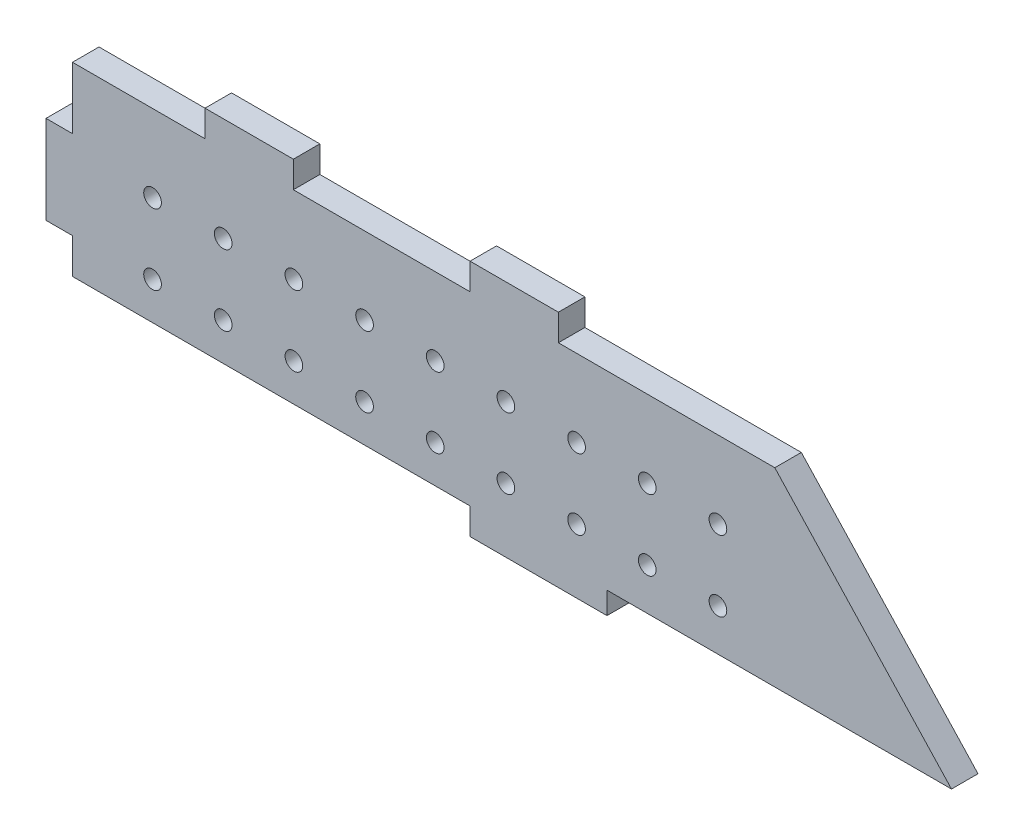
from build123d import *

# Parameters (mm, degrees)
ESQUISSE1_W             = 199
ESQUISSE1_H             = 48
BOSS_EXTRU_1_DEPTH      = 6
ESQUISSE2_W             = 20
ESQUISSE2_H             = 6
BOSS_EXTRU_2_DEPTH      = 6
ESQUISSE3_W             = 6
ESQUISSE3_H             = 20
BOSS_EXTRU_3_DEPTH      = 6
ESQUISSE4_W             = 78
ESQUISSE4_H             = 5
ENL_V_MAT_EXTRU_1_DEPTH = 213.077815907
ENL_V_MAT_EXTRU_2_DEPTH = 213.077815907
ESQUISSE6_R             = 1.005
ENL_V_MAT_EXTRU_3_DEPTH = 213.077815907
ESQUISSE7_R             = 2
ENL_V_MAT_EXTRU_4_DEPTH = 3
ESQUISSE8_W             = 90
ESQUISSE8_H             = 6
ENL_V_MAT_EXTRU_5_DEPTH = 213.077815907


with BuildPart() as part:
    # Esquisse1 → Boss.-Extru.1 (new body)
    with BuildSketch(Plane.XY):
        with Locations((-99.5, 24)):
            Rectangle(ESQUISSE1_W, ESQUISSE1_H)
    extrude(amount=BOSS_EXTRU_1_DEPTH)

    # Esquisse2 → Boss.-Extru.2 (add)
    with BuildSketch(Plane(origin=(0, 48, 0), x_dir=(1, 0, 0), z_dir=(0, 1, 0))):
        with Locations((-99, -3)):
            Rectangle(ESQUISSE2_W, ESQUISSE2_H)
        with Locations((-159, -3)):
            Rectangle(ESQUISSE2_W, ESQUISSE2_H)
    extrude(amount=BOSS_EXTRU_2_DEPTH)

    # Esquisse3 → Boss.-Extru.3 (add)
    with BuildSketch(Plane.ZY.offset(199)):
        with Locations((3, 24)):
            Rectangle(ESQUISSE3_W, ESQUISSE3_H)
    extrude(amount=BOSS_EXTRU_3_DEPTH)

    # Esquisse4 → Enlèv. mat.-Extru.1 (cut, through all)
    with BuildSketch(Plane.XY.offset(6)):
        with Locations((-39, 2.5)):
            Rectangle(ESQUISSE4_W, ESQUISSE4_H)
    extrude(amount=-ENL_V_MAT_EXTRU_1_DEPTH, mode=Mode.SUBTRACT)

    # Esquisse5 → Enlèv. mat.-Extru.2 (cut, through all)
    with BuildSketch(Plane.XY.offset(6)):
        Polygon((0, 48), (-40, 48), (0, 5), align=None)
    extrude(amount=-ENL_V_MAT_EXTRU_2_DEPTH, mode=Mode.SUBTRACT)

    # Esquisse6 → Enlèv. mat.-Extru.3 (cut, through all)
    with BuildSketch(Plane.XY.offset(6)):
        with Locations((-148.88, 14.5)):
            Circle(ESQUISSE6_R)
        with Locations((-148.88, 30.5)):
            Circle(ESQUISSE6_R)
        with Locations((-132.88, 14.5)):
            Circle(ESQUISSE6_R)
        with Locations((-132.88, 30.5)):
            Circle(ESQUISSE6_R)
        with Locations((-116.88, 14.5)):
            Circle(ESQUISSE6_R)
        with Locations((-116.88, 30.5)):
            Circle(ESQUISSE6_R)
        with Locations((-100.88, 14.5)):
            Circle(ESQUISSE6_R)
        with Locations((-100.88, 30.5)):
            Circle(ESQUISSE6_R)
        with Locations((-84.88, 14.5)):
            Circle(ESQUISSE6_R)
        with Locations((-84.88, 30.5)):
            Circle(ESQUISSE6_R)
        with Locations((-68.88, 14.5)):
            Circle(ESQUISSE6_R)
        with Locations((-68.88, 30.5)):
            Circle(ESQUISSE6_R)
        with Locations((-52.88, 14.5)):
            Circle(ESQUISSE6_R)
        with Locations((-52.88, 30.5)):
            Circle(ESQUISSE6_R)
        with Locations((-164.88, 14.5)):
            Circle(ESQUISSE6_R)
        with Locations((-164.88, 30.5)):
            Circle(ESQUISSE6_R)
        with Locations((-180.88, 14.5)):
            Circle(ESQUISSE6_R)
        with Locations((-180.88, 30.5)):
            Circle(ESQUISSE6_R)
    extrude(amount=-ENL_V_MAT_EXTRU_3_DEPTH, mode=Mode.SUBTRACT)

    # Esquisse7 → Enlèv. mat.-Extru.4 (cut)
    with BuildSketch(Plane.XY.offset(6)):
        with Locations((-52.88, 14.5)):
            Circle(ESQUISSE7_R)
        with Locations((-52.88, 30.5)):
            Circle(ESQUISSE7_R)
        with Locations((-68.88, 14.5)):
            Circle(ESQUISSE7_R)
        with Locations((-68.88, 30.5)):
            Circle(ESQUISSE7_R)
        with Locations((-84.88, 14.5)):
            Circle(ESQUISSE7_R)
        with Locations((-84.88, 30.5)):
            Circle(ESQUISSE7_R)
        with Locations((-100.88, 14.5)):
            Circle(ESQUISSE7_R)
        with Locations((-100.88, 30.5)):
            Circle(ESQUISSE7_R)
        with Locations((-116.88, 14.5)):
            Circle(ESQUISSE7_R)
        with Locations((-116.88, 30.5)):
            Circle(ESQUISSE7_R)
        with Locations((-132.88, 14.5)):
            Circle(ESQUISSE7_R)
        with Locations((-132.88, 30.5)):
            Circle(ESQUISSE7_R)
        with Locations((-148.88, 14.5)):
            Circle(ESQUISSE7_R)
        with Locations((-148.88, 30.5)):
            Circle(ESQUISSE7_R)
        with Locations((-164.88, 14.5)):
            Circle(ESQUISSE7_R)
        with Locations((-164.88, 30.5)):
            Circle(ESQUISSE7_R)
        with Locations((-180.88, 14.5)):
            Circle(ESQUISSE7_R)
        with Locations((-180.88, 30.5)):
            Circle(ESQUISSE7_R)
    extrude(amount=-ENL_V_MAT_EXTRU_4_DEPTH, mode=Mode.SUBTRACT)

    # Esquisse8 → Enlèv. mat.-Extru.5 (cut, through all)
    with BuildSketch(Plane(origin=(0, 0, 0), x_dir=(-1, 0, 0), z_dir=(0, 0, -1))):
        with Locations((154, 3)):
            Rectangle(ESQUISSE8_W, ESQUISSE8_H)
    extrude(amount=-ENL_V_MAT_EXTRU_5_DEPTH, mode=Mode.SUBTRACT)


solid = part.part
